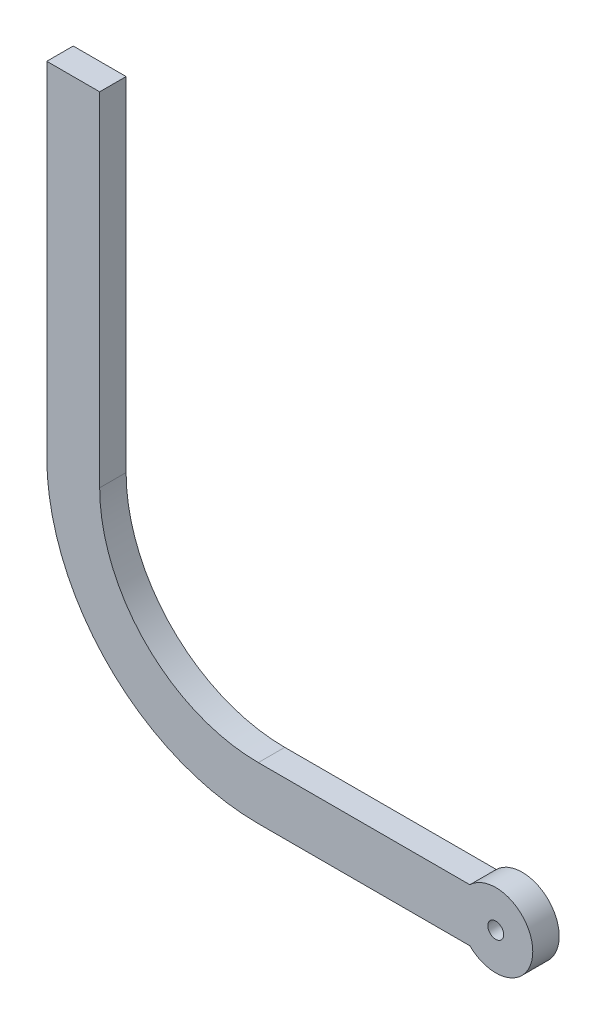
from build123d import *

# Parameters (mm, degrees)
SKETCH1_R           = 1.5
BOSS_EXTRUDE1_DEPTH = 5


with BuildPart() as part:
    # Sketch1 → Boss-Extrude1 (new body)
    with BuildSketch(Plane.XY):
        with BuildLine():
            Line((-4.898979486, 5), (-44.898979486, 5))
            ThreePointArc((-44.898979486, 5), (-66.112182921, 13.786796564), (-74.898979486, 35))
            Line((-74.898979486, 35), (-74.898979486, 99.854241238))
            Line((-74.898979486, 99.854241238), (-84.898979486, 99.854241238))
            Line((-84.898979486, 99.854241238), (-84.898979486, 35))
            ThreePointArc((-84.898979486, 35), (-73.183250733, 6.715728753), (-44.898979486, -5))
            Line((-44.898979486, -5), (-4.898979486, -5))
            ThreePointArc((-4.898979486, -5), (7, 0), (-4.898979486, 5))
        make_face()
        Circle(SKETCH1_R, mode=Mode.SUBTRACT)
    extrude(amount=BOSS_EXTRUDE1_DEPTH)


solid = part.part
